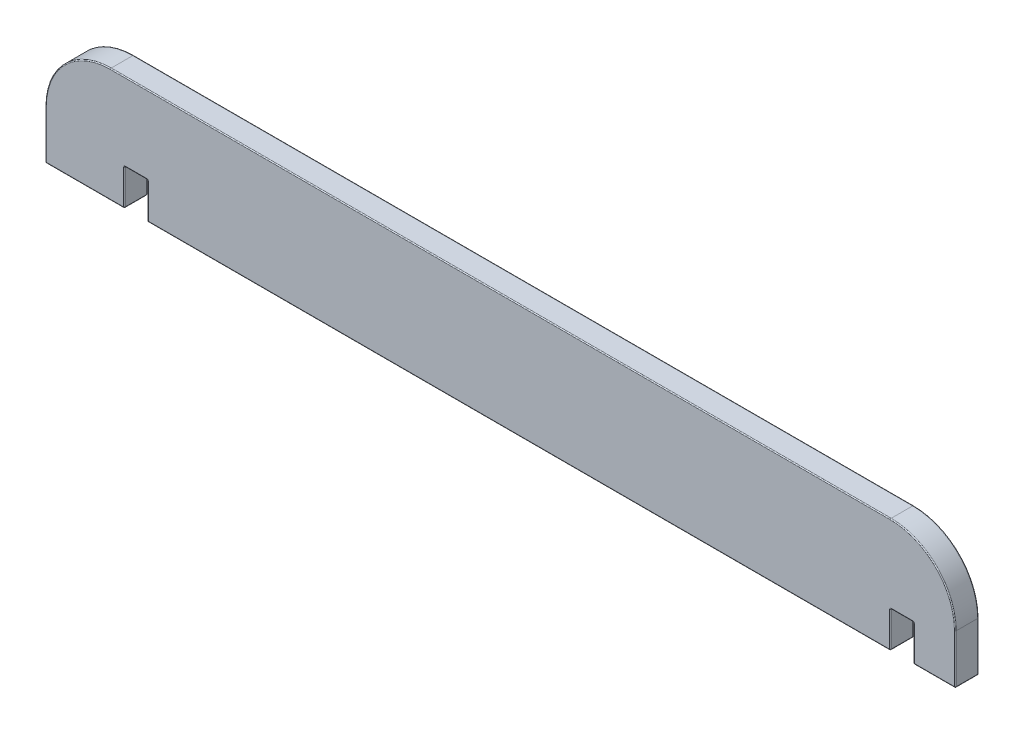
from build123d import *

# Parameters (mm, degrees)
RESSALTO_EXTRUS_O1_DEPTH = 2.5
FILETE1_R                = 0.1


with BuildPart() as part:
    # Esboço1 → Ressalto-extrusão1 (new body)
    with BuildSketch(Plane.XY):
        with BuildLine():
            Line((60.523872434, -95.459023636), (60.523872434, -100.759023636))
            Line((60.523872434, -100.759023636), (69.023872434, -100.759023636))
            Line((69.023872434, -100.759023636), (69.023872434, -96.859023636))
            Line((69.023872434, -96.859023636), (71.523872434, -96.859023636))
            Line((71.523872434, -96.859023636), (71.523872434, -100.759023636))
            Line((71.523872434, -100.759023636), (151.523872434, -100.759023636))
            Line((151.523872434, -100.759023636), (151.523872434, -96.859023636))
            Line((151.523872434, -96.859023636), (154.023872434, -96.859023636))
            Line((154.023872434, -96.859023636), (154.023872434, -100.759023636))
            Line((154.023872434, -100.759023636), (158.523872434, -100.759023636))
            Line((158.523872434, -100.759023636), (158.523872434, -95.459023636))
            ThreePointArc((158.523872434, -95.459023636), (156.473619903, -90.509276168), (151.523872434, -88.459023636))
            Line((151.523872434, -88.459023636), (67.523872434, -88.459023636))
            ThreePointArc((67.523872434, -88.459023636), (62.574124966, -90.509276168), (60.523872434, -95.459023636))
        make_face()
    extrude(amount=RESSALTO_EXTRUS_O1_DEPTH)

    # Filete1
    filete1_edges = [part.edges().sort_by_distance(p)[0] for p in [
        (64.773872434, -100.759023636, 2.5),
        (109.523872434, -88.459023636, 0),
        (156.473619903, -90.509276168, 0),
        (158.523872434, -98.109023636, 0),
        (156.273872434, -100.759023636, 0),
        (154.023872434, -98.809023636, 0),
        (152.773872434, -96.859023636, 0),
        (69.023872434, -98.809023636, 2.5),
        (151.523872434, -98.809023636, 0),
        (111.523872434, -100.759023636, 0),
        (71.523872434, -98.809023636, 0),
        (70.273872434, -96.859023636, 0),
        (69.023872434, -98.809023636, 0),
        (64.773872434, -100.759023636, 0),
        (60.523872434, -98.109023636, 0),
        (62.574124966, -90.509276168, 0),
        (70.273872434, -96.859023636, 2.5),
        (71.523872434, -98.809023636, 2.5),
        (158.523872434, -100.759023636, 1.25),
        (154.023872434, -100.759023636, 1.25),
        (154.023872434, -96.859023636, 1.25),
        (151.523872434, -96.859023636, 1.25),
        (151.523872434, -100.759023636, 1.25),
        (71.523872434, -100.759023636, 1.25),
        (71.523872434, -96.859023636, 1.25),
        (69.023872434, -96.859023636, 1.25),
        (69.023872434, -100.759023636, 1.25),
        (60.523872434, -100.759023636, 1.25),
        (111.523872434, -100.759023636, 2.5),
        (151.523872434, -98.809023636, 2.5),
        (152.773872434, -96.859023636, 2.5),
        (154.023872434, -98.809023636, 2.5),
        (156.273872434, -100.759023636, 2.5),
        (158.523872434, -98.109023636, 2.5),
        (62.574124966, -90.509276168, 2.5),
        (156.473619903, -90.509276168, 2.5),
        (109.523872434, -88.459023636, 2.5),
        (60.523872434, -98.109023636, 2.5),
    ]]
    fillet(filete1_edges, radius=FILETE1_R)


solid = part.part
